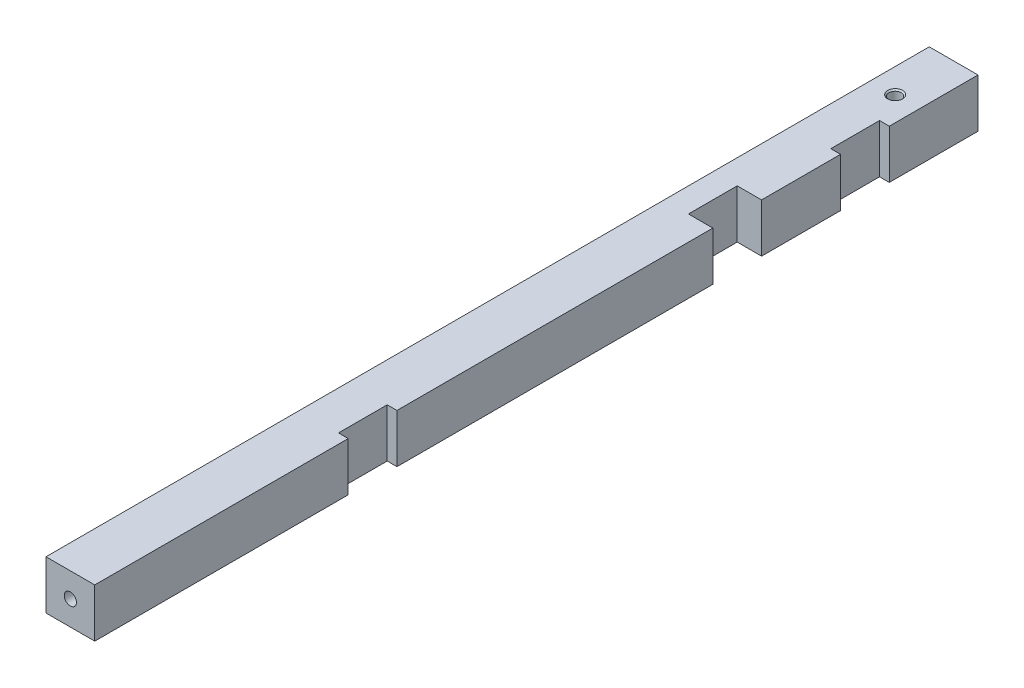
from build123d import *

# Parameters (mm, degrees)
BOSS_EXTRU_1_DEPTH              = 179.2
BOSS_EXTRU_1_DEPTH_BACK         = 2
ESQUISSE1_W                     = 10
ESQUISSE1_H                     = 10
ESQUISSE2_W                     = 2
ESQUISSE2_H                     = 10
ESQUISSE2_W_2                   = 5
ENL_V_MAT_EXTRU_1_DEPTH         = 180.548433577
TROU_TARAUD_M3X0_51_D           = 2.5
TROU_TARAUD_M3X0_51_CSINK_D     = 3.05
TROU_TARAUD_M3X0_51_CSINK_ANGLE = 90
TROU_TARAUD_M3X0_52_D           = 2.5
TROU_TARAUD_M3X0_52_DEPTH       = 8.5


with BuildPart() as part:
    # Esquisse1 → Boss.-Extru.1 (new, two sides: drawn at the far end of the back side and taken through both)
    with BuildSketch(Plane.XY.offset(-BOSS_EXTRU_1_DEPTH_BACK)):
        Rectangle(ESQUISSE1_W, ESQUISSE1_H)
    extrude(amount=BOSS_EXTRU_1_DEPTH + BOSS_EXTRU_1_DEPTH_BACK)

    # Esquisse2 → Enlèv. mat.-Extru.1 (cut, through all)
    with BuildSketch(Plane(origin=(0, 5, 0), x_dir=(1, 0, 0), z_dir=(0, 1, 0))):
        with Locations((4, -122.2)):
            Rectangle(ESQUISSE2_W, ESQUISSE2_H)
        with Locations((4, -21.2)):
            Rectangle(ESQUISSE2_W, ESQUISSE2_H)
        with Locations((2.5, -47.4)):
            Rectangle(ESQUISSE2_W_2, ESQUISSE2_H)
    extrude(amount=-ENL_V_MAT_EXTRU_1_DEPTH, mode=Mode.SUBTRACT)

    # Trou taraudé M3x0.51 (through all)
    with Locations(Plane(origin=(0, 5, 0), x_dir=(1, 0, 0), z_dir=(0, 1, 0))):
        with Locations((0, -10)):
            CounterSinkHole(TROU_TARAUD_M3X0_51_D / 2, TROU_TARAUD_M3X0_51_CSINK_D / 2, counter_sink_angle=TROU_TARAUD_M3X0_51_CSINK_ANGLE)

    # Trou taraudé M3x0.52
    with Locations(Plane.XY.offset(179.2)):
        with Locations((0, 0)):
            Hole(TROU_TARAUD_M3X0_52_D / 2, depth=TROU_TARAUD_M3X0_52_DEPTH)


solid = part.part
